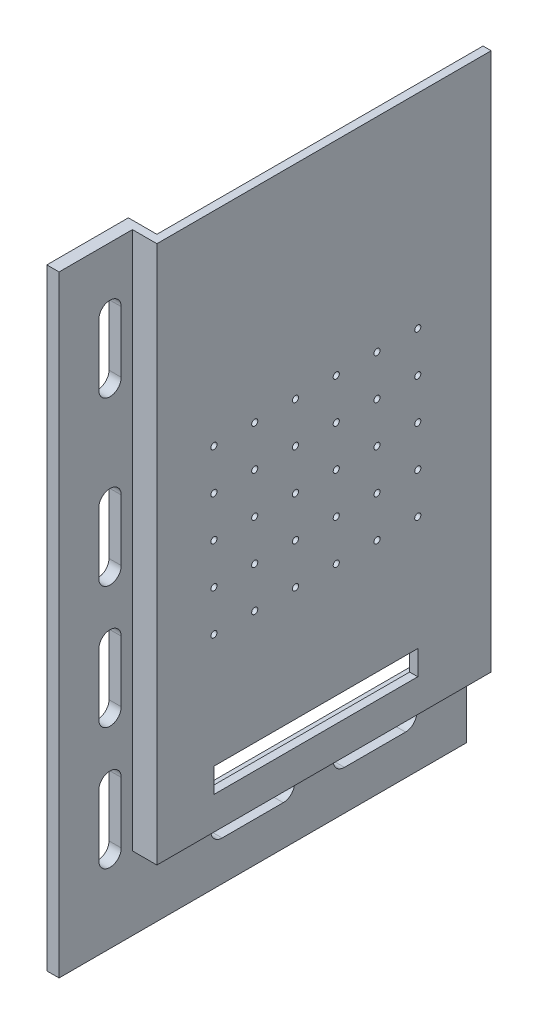
from build123d import *

# Parameters (mm, degrees)
EXTRUDE_1_DEPTH             = 3
EXTRUDE_2_DEPTH             = 6
EXTRUDE_3_DEPTH             = 3
SKETCH_5_W                  = 2
SKETCH_5_H                  = 80
EXTRUDE_4_DEPTH             = 130
SKETCH_6_W                  = 50
SKETCH_6_H                  = 6
CUT_EXTRUDE_1_DEPTH         = 130
SKETCH_7_W                  = 14.471008782
SKETCH_7_H                  = 21.149935912
SKETCH_7_W_2                = 15.39863755
SKETCH_7_W_3                = 10.018390695
SKETCH_7_H_2                = 20.222307144
SKETCH_7_W_4                = 5.936824115
SKETCH_7_H_3                = 22.263090434
EXTRUDE_5_DEPTH             = 2
SKETCH_8_R                  = 0.75
CUT_EXTRUDE_2_DEPTH         = 2
PATTERN_LINEAR_1_COUNT      = 5
PATTERN_LINEAR_1_PITCH      = 10
PATTERN_LINEAR_1_COUNT_DIR2 = 6
PATTERN_LINEAR_1_PITCH_DIR2 = 10


with BuildPart() as part:
    # 草图1 → 凸台-拉伸1 (new body)
    with BuildSketch(Plane(origin=(0, 0, 0), x_dir=(0, 0, -1), z_dir=(1, 0, 0))):
        Polygon((0, 0), (0, 150), (18, 150), (18, 18), (100, 18), (100, 0), align=None)
        with BuildLine():
            ThreePointArc((85, 9.75), (87.75, 12.5), (85, 15.25))
            Line((85, 15.25), (70, 15.25))
            ThreePointArc((70, 15.25), (67.25, 12.5), (70, 9.75))
            Line((70, 9.75), (85, 9.75))
        make_face(mode=Mode.SUBTRACT)
        with BuildLine():
            ThreePointArc((55, 9.75), (57.75, 12.5), (55, 15.25))
            Line((55, 15.25), (40, 15.25))
            ThreePointArc((40, 15.25), (37.25, 12.5), (40, 9.75))
            Line((40, 9.75), (55, 9.75))
        make_face(mode=Mode.SUBTRACT)
        with BuildLine():
            ThreePointArc((15.25, 135), (12.5, 137.75), (9.75, 135))
            Line((9.75, 135), (9.75, 120))
            ThreePointArc((9.75, 120), (12.5, 117.25), (15.25, 120))
            Line((15.25, 120), (15.25, 135))
        make_face(mode=Mode.SUBTRACT)
        with BuildLine():
            ThreePointArc((15.25, 95), (12.5, 97.75), (9.75, 95))
            Line((9.75, 95), (9.75, 80))
            ThreePointArc((9.75, 80), (12.5, 77.25), (15.25, 80))
            Line((15.25, 80), (15.25, 95))
        make_face(mode=Mode.SUBTRACT)
        with BuildLine():
            ThreePointArc((15.25, 65), (12.5, 67.75), (9.75, 65))
            Line((9.75, 65), (9.75, 50))
            ThreePointArc((9.75, 50), (12.5, 47.25), (15.25, 50))
            Line((15.25, 50), (15.25, 65))
        make_face(mode=Mode.SUBTRACT)
        with BuildLine():
            ThreePointArc((15.25, 35), (12.5, 37.75), (9.75, 35))
            Line((9.75, 35), (9.75, 20))
            ThreePointArc((9.75, 20), (12.5, 17.25), (15.25, 20))
            Line((15.25, 20), (15.25, 35))
        make_face(mode=Mode.SUBTRACT)
    extrude(amount=EXTRUDE_1_DEPTH)



with BuildPart() as body_2:
    # 草图2 → 凸台-拉伸2 (new body)
    with BuildSketch(Plane(origin=(3, 0, 0), x_dir=(0, 0, -1), z_dir=(1, 0, 0))):
        Polygon((18, 150), (20, 150), (20, 20), (100, 20), (100, 18), (20, 18), (18, 18), align=None)
    extrude(amount=EXTRUDE_2_DEPTH)


with BuildPart() as part_1:
    add(part.part)

    add(body_2.part)  # 凸台-拉伸3 merges body 2
    # 草图4 → 凸台-拉伸3 (add)
    with BuildSketch(Plane.ZY.offset(-3)):
        Polygon((-18, 18), (-18, 150), (-20, 150), (-20, 20), (-100, 20), (-100, 18), align=None)
    extrude(amount=EXTRUDE_3_DEPTH)

    # 草图5 → 凸台-拉伸4 (add)
    with BuildSketch(Plane(origin=(0, 20, 0), x_dir=(1, 0, 0), z_dir=(0, 1, 0))):
        with Locations((8, 60)):
            Rectangle(SKETCH_5_W, SKETCH_5_H)
    extrude(amount=EXTRUDE_4_DEPTH)

    # 草图6 → 切除-拉伸1 (cut)
    with BuildSketch(Plane.ZY.offset(-7)):
        with Locations((-57, 29)):
            Rectangle(SKETCH_6_W, SKETCH_6_H)
    extrude(amount=-CUT_EXTRUDE_1_DEPTH, mode=Mode.SUBTRACT)

    # 草图7 → 凸台-拉伸5 (add)
    with BuildSketch(Plane.ZY.offset(-7)):
        with Locations((-86.256785513, 132.445159505)):
            Rectangle(SKETCH_7_W, SKETCH_7_H)
        with Locations((-34.031285871, 132.445159505)):
            Rectangle(SKETCH_7_W_2, SKETCH_7_H)
        with Locations((-88.483094557, 39.218468314)):
            Rectangle(SKETCH_7_W_3, SKETCH_7_H_2)
        with Locations((-27.074070111, 38.198076669)):
            Rectangle(SKETCH_7_W_4, SKETCH_7_H_3)
    extrude(amount=EXTRUDE_5_DEPTH)

    # 草图8 → 切除-拉伸2 (cut)
    with BuildSketch(Plane.ZY.offset(-7)):
        with Locations((-82, 100)):
            Circle(SKETCH_8_R)
    cut_extrude_2 = extrude(amount=-CUT_EXTRUDE_2_DEPTH, mode=Mode.SUBTRACT)

    # 阵列(线性)1: Cut-Extrude 2 5 × 6
    with Locations(*[(0, -i * PATTERN_LINEAR_1_PITCH, j * PATTERN_LINEAR_1_PITCH_DIR2) for i in range(PATTERN_LINEAR_1_COUNT) for j in range(PATTERN_LINEAR_1_COUNT_DIR2) if (i, j) != (0, 0)]):
        add(cut_extrude_2, mode=Mode.SUBTRACT)


solid = part_1.part
